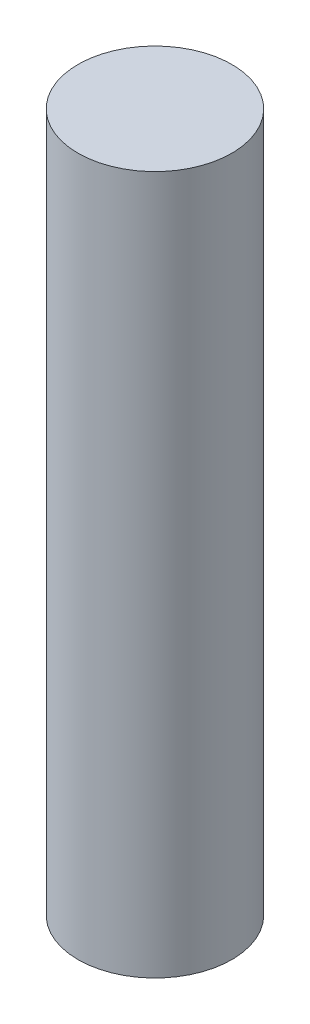
from build123d import *

# Parameters (mm, degrees)
SKETCH2_R           = 10.795
BOSS_EXTRUDE1_DEPTH = 98


with BuildPart() as part:
    # Sketch2 → Boss-Extrude1 (new body)
    with BuildSketch(Plane(origin=(0, 0, 0), x_dir=(1, 0, 0), z_dir=(0, 1, 0))):
        with Locations(Location((0, 0, 0), (0, 0, 270))):
            Circle(SKETCH2_R)
    extrude(amount=BOSS_EXTRUDE1_DEPTH)


solid = part.part
